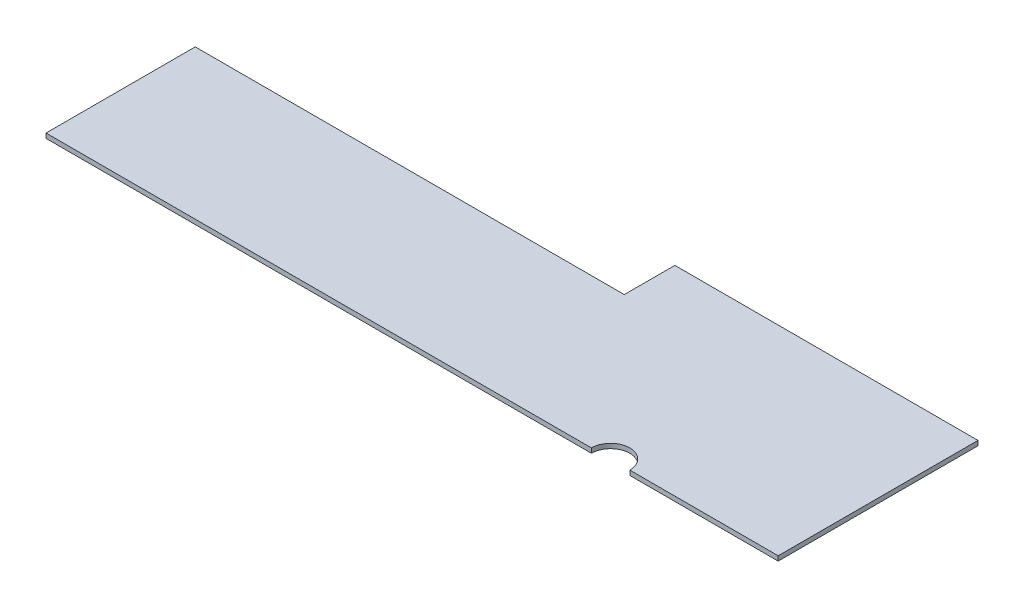
from build123d import *

# Parameters (mm, degrees)
BOSS_EXTRUDE1_DEPTH = 1.5875


with BuildPart() as part:
    # Sketch1 → Boss-Extrude1 (new, symmetric)
    with BuildSketch(Plane(origin=(0, 0, 0), x_dir=(1, 0, 0), z_dir=(0, 1, 0))):
        with BuildLine():
            Line((1020.4196, -520.7), (1020.4196, -384.668661408))
            Line((1020.4196, -384.668661408), (1017.2446, -384.668661408))
            Line((1017.2446, -384.668661408), (814.0446, -384.668661408))
            Line((814.0446, -384.668661408), (814.0446, -419.1))
            Line((814.0446, -419.1), (525.1196, -419.1))
            Line((525.1196, -419.1), (521.9446, -419.1))
            Line((521.9446, -419.1), (521.9446, -520.7))
            Line((521.9446, -520.7), (525.1196, -520.7))
            Line((525.1196, -520.7), (893.2418, -520.7))
            ThreePointArc((893.2418, -520.7), (906.3228, -507.619), (919.4038, -520.7))
            Line((919.4038, -520.7), (1020.4196, -520.7))
        make_face()
    extrude(amount=BOSS_EXTRUDE1_DEPTH, both=True)


solid = part.part
